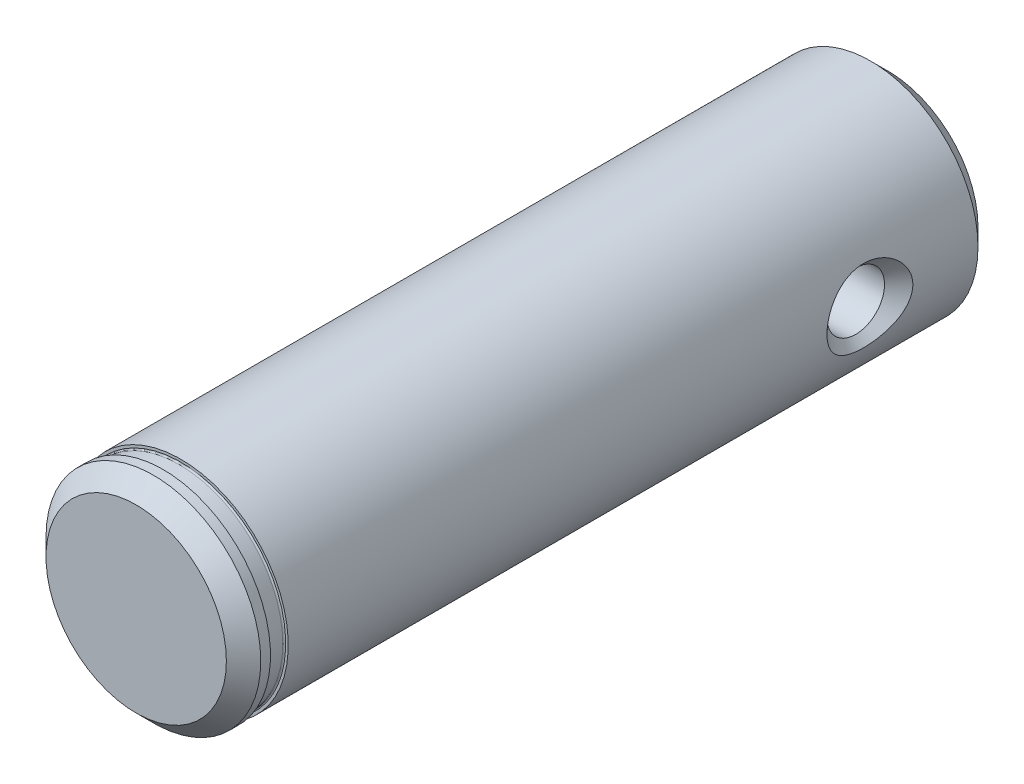
from build123d import *

# Parameters (mm, degrees)
SKETCH1_R           = 9.525
BOSS_EXTRUDE1_DEPTH = 33.3375
CHAMFER1_SIZE       = 1.524


with BuildPart() as part:
    # Sketch1 → Boss-Extrude1 (new, symmetric)
    with BuildSketch(Plane.XY):
        Circle(SKETCH1_R)
    extrude(amount=BOSS_EXTRUDE1_DEPTH, both=True)

    # Chamfer1
    chamfer1_edges = [part.edges().sort_by_distance(p)[0] for p in [
        (-9.525, 0, -33.3375),
        (-9.525, 0, 33.3375),
    ]]
    chamfer(chamfer1_edges, length=CHAMFER1_SIZE)

    # Sketch3 → 1/4-20 Tapped Hole1 (revolve, cut)
    with BuildSketch(Plane(origin=(-9.525, 0, -22.225), x_dir=(0, 0, 1), z_dir=(0, 1, 0))):
        Polygon((0, 0), (0, 19.05), (3.81, 19.05), (2.5527, 17.7927), (2.5527, 1.2573), (3.81, 0), align=None)
    revolve(axis=Axis((-15.875, 0, -22.225), (1, 0, 0)), mode=Mode.SUBTRACT)

    # Groove Sketch → Retaining Ring Groove (revolve, cut)
    with BuildSketch(Plane(origin=(9.513189126, 2.614578126, 39.123243658), x_dir=(-0.3010163797724101, -0.08273049466574514, 0.9500235809500064), z_dir=(0.26501052487715226, -0.9642455194110764, 0)), mode=Mode.PRIVATE) as retaining_ring_groove_sk:
        with BuildLine():
            Line((-1.782805189, 20.756214823), (-1.711441265, 20.973390213))
            Line((-1.711441265, 20.973390213), (-3.2075384, 21.46500836))
            Line((-3.2075384, 21.46500836), (-3.278902324, 21.247832969))
            ThreePointArc((-3.278902324, 21.247832969), (-3.271598278, 21.150906191), (-3.197895954, 21.08753335))
            Line((-3.197895954, 21.08753335), (-1.943104809, 20.675208453))
            ThreePointArc((-1.943104809, 20.675208453), (-1.84617803, 20.682512499), (-1.782805189, 20.756214823))
        make_face()
    revolve(retaining_ring_groove_sk.sketch.rotate(Axis((0, 0, 54.757401128), (0, 0, -1)), 15.367578188), axis=Axis((0, 0, 54.757401128), (0, 0, -1)), mode=Mode.SUBTRACT)


solid = part.part
